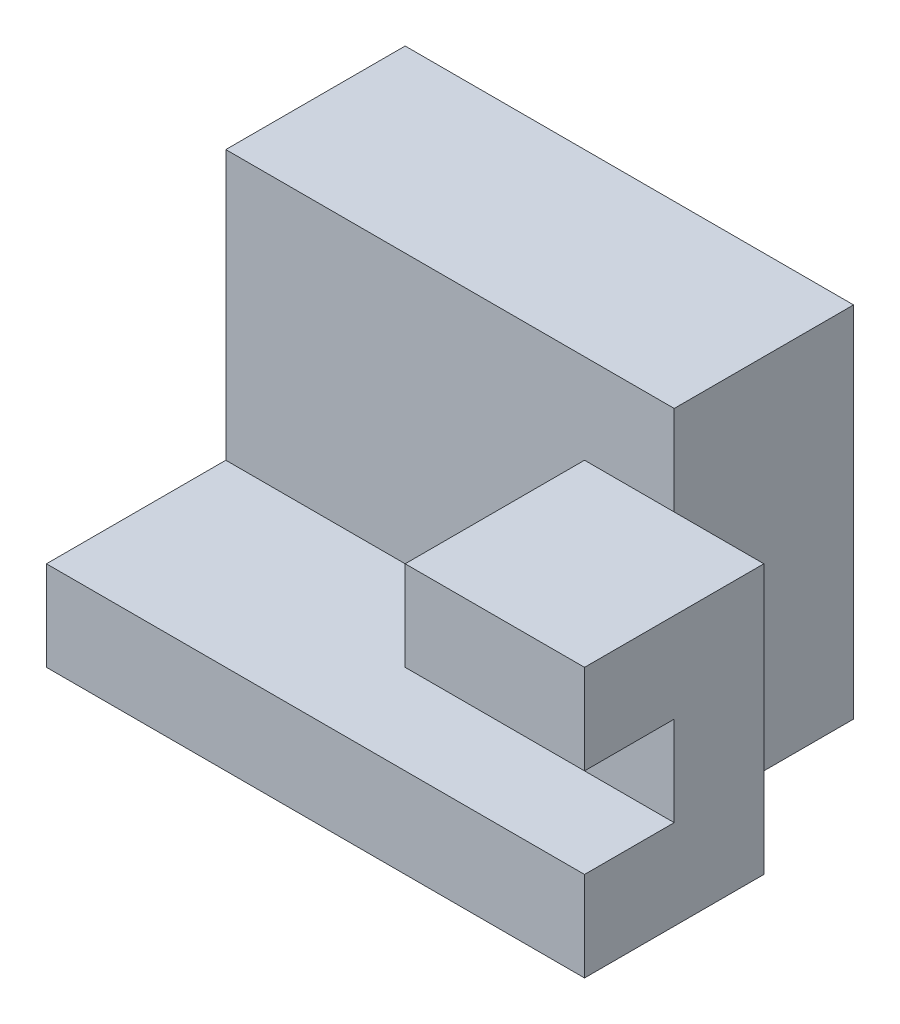
from build123d import *

# Parameters (mm, degrees)
SKETCH1_W           = 50
SKETCH1_H           = 20
BOSS_EXTRUDE1_DEPTH = 40
SKETCH2_W           = 20
SKETCH2_H           = 10
BOSS_EXTRUDE2_DEPTH = 40
BOSS_EXTRUDE3_DEPTH = 20


with BuildPart() as part:
    # Sketch1 → Boss-Extrude1 (new body)
    with BuildSketch(Plane(origin=(0, 0, 0), x_dir=(1, 0, 0), z_dir=(0, 1, 0))):
        Rectangle(SKETCH1_W, SKETCH1_H)
    extrude(amount=-BOSS_EXTRUDE1_DEPTH)

    # Sketch2 → Boss-Extrude2 (add)
    with BuildSketch(Plane.ZY.offset(25)):
        with Locations((20, -35)):
            Rectangle(SKETCH2_W, SKETCH2_H)
    extrude(amount=-BOSS_EXTRUDE2_DEPTH)

    # Sketch3 → Boss-Extrude3 (add)
    with BuildSketch(Plane(origin=(15, 0, 0), x_dir=(0, 0, -1), z_dir=(1, 0, 0))):
        Polygon((-30, -40), (-10, -40), (-10, -10), (-30, -10), (-30, -20), (-20, -20), (-20, -30), (-30, -30), align=None)
    extrude(amount=BOSS_EXTRUDE3_DEPTH)


solid = part.part
